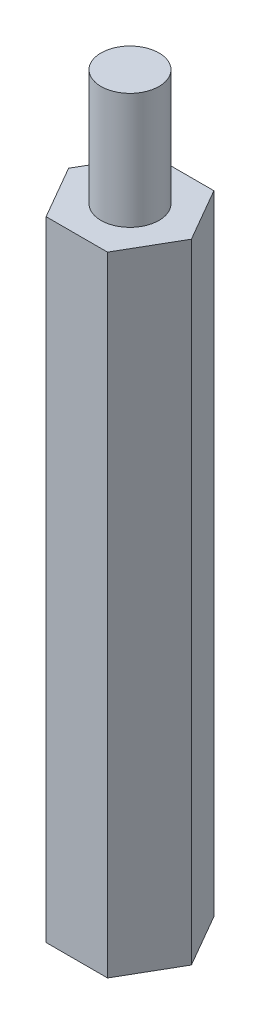
from build123d import *

# Parameters (mm, degrees)
BOSS_EXTRUDE1_DEPTH = 32.5
SKETCH2_R           = 1.5
CUT_EXTRUDE1_DEPTH  = 6
BOSS_EXTRUDE2_START = -32.5
SKETCH2_2_R         = 1.5
BOSS_EXTRUDE2_DEPTH = 6


with BuildPart() as part:
    # Sketch1 → Boss-Extrude1 (new body)
    with BuildSketch(Plane(origin=(0, 0, 0), x_dir=(1, 0, 0), z_dir=(0, 1, 0))):
        Polygon((1.58771324, -2.75), (3.175426481, 0), (1.58771324, 2.75), (-1.58771324, 2.75), (-3.175426481, 0), (-1.58771324, -2.75), align=None)
    extrude(amount=BOSS_EXTRUDE1_DEPTH)

    # Sketch2 → Cut-Extrude1 (cut)
    with BuildSketch(Plane.XZ):
        with Locations(Location((0, 0, 0), (0, 0, 270))):
            Circle(SKETCH2_R)
    extrude(amount=-CUT_EXTRUDE1_DEPTH, mode=Mode.SUBTRACT)

    # Sketch2<2> → Boss-Extrude2 (add)
    with BuildSketch(Plane.XZ.offset(BOSS_EXTRUDE2_START)):
        with Locations(Location((0, 0, 0), (0, 0, 270))):
            Circle(SKETCH2_2_R)
    extrude(amount=-BOSS_EXTRUDE2_DEPTH)


solid = part.part
